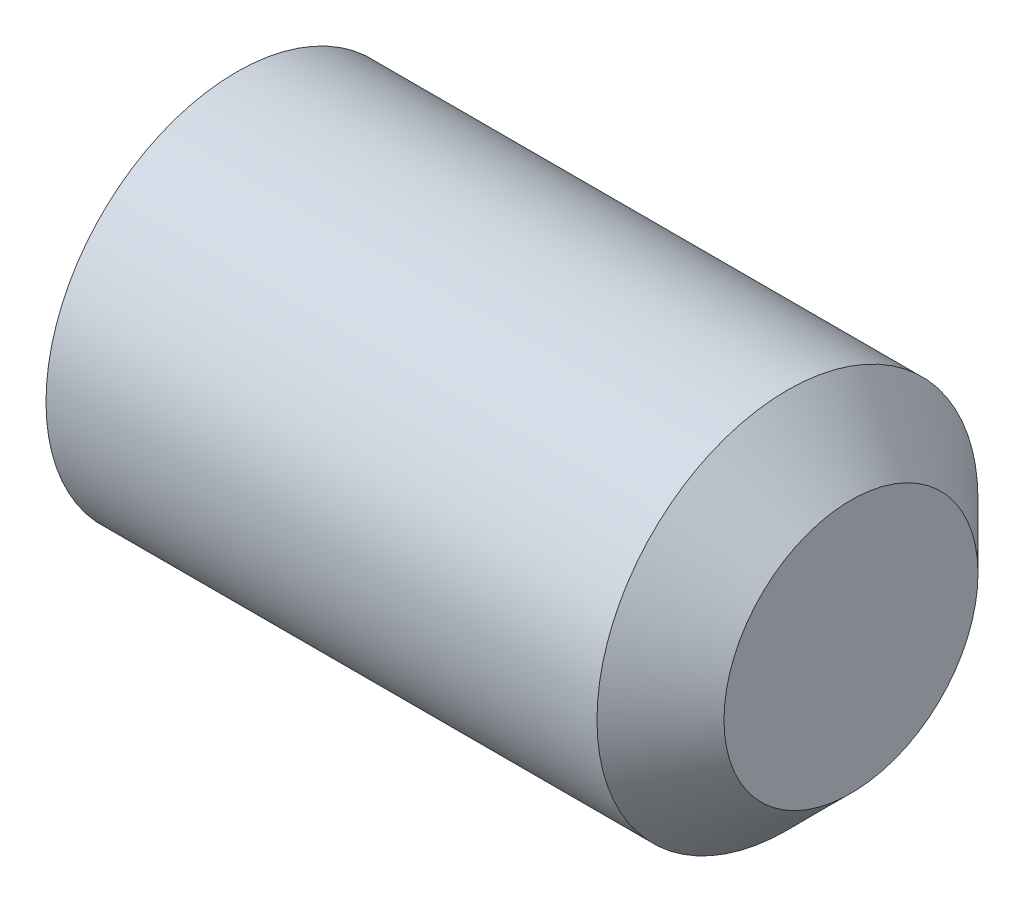
from build123d import *

# Parameters (mm, degrees)
HEX_2_DEPTH = 2.1


with BuildPart() as part:
    # BodySke → BaseBody (revolve)
    with BuildSketch(Plane.XY, mode=Mode.PRIVATE) as basebody_sk:
        Polygon((0, 0), (0, 1.2195), (0.161946751, 1.5), (4.5, 1.5), (5, 1), (5, 0), align=None)
    revolve(basebody_sk.sketch.rotate(Axis((-12.7, 0, 0), (1, 0, 0)), 90), axis=Axis((-12.7, 0, 0), (1, 0, 0)))

    # Sketch2 → Hex 2 (cut)
    with BuildSketch(Plane.ZY):
        Polygon((0.433012702, 0.75), (-0.433012702, 0.75), (-0.866025404, 0), (-0.433012702, -0.75), (0.433012702, -0.75), (0.866025404, 0), align=None)
    extrude(amount=-HEX_2_DEPTH, mode=Mode.SUBTRACT)


solid = part.part
